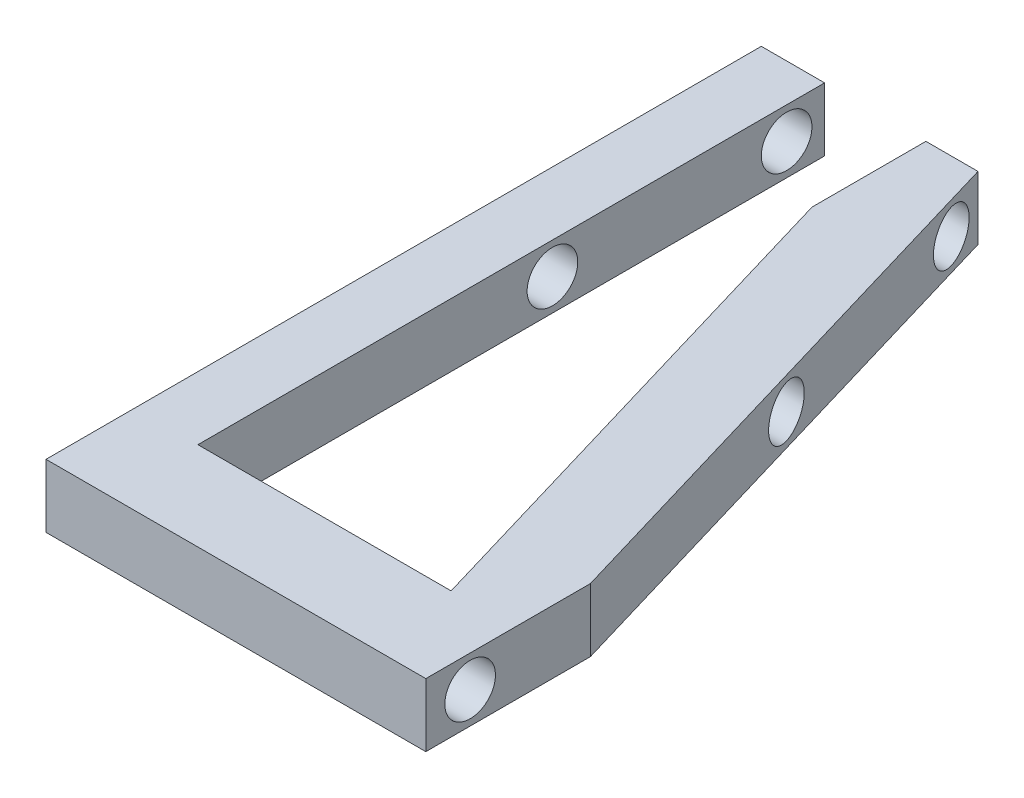
from build123d import *

# Parameters (mm, degrees)
BOSS_EXTRUDE1_DEPTH = 2.5
CUT_EXTRUDE1_REACH  = 59.935
SKETCH2_R           = 2


with BuildPart() as part:
    # Sketch1 → Boss-Extrude1 (new, symmetric)
    with BuildSketch(Plane(origin=(0, 0, 0), x_dir=(1, 0, 0), z_dir=(0, 1, 0))):
        Polygon((-9.999056518, 49.5), (-14.999056518, 49.5), (-14.999056518, -7), (15.000943482, -7), (15.000943482, 6), (2.115656451, 49.5), (-1.999056518, 49.5), (-1.999056518, 40.504950791), (9.999056518, 0), (-9.999056518, 0), align=None)
    extrude(amount=BOSS_EXTRUDE1_DEPTH, both=True)

    # Cut-Extrude1: up to this face of the body (flat: up to its plane)
    cut_extrude1_end = Plane(part.part.faces().sort_by_distance((15.000943482, 0, 0.5))[0])
    # Sketch2 → Cut-Extrude1 (cut, up to the picked face)
    with BuildSketch(Plane.ZY.offset(14.999056518), mode=Mode.PRIVATE) as cut_extrude1_sk1:
        with Locations(Location((-46.5, 0, 0), (0, 0, 180))):
            Circle(SKETCH2_R)
    cut_extrude1_tool1 = split(extrude(cut_extrude1_sk1.sketch, amount=-CUT_EXTRUDE1_REACH, mode=Mode.PRIVATE), bisect_by=cut_extrude1_end, keep=Keep.BOTH, mode=Mode.PRIVATE)
    # Sketch2 → Cut-Extrude1 (cut, up to the picked face)
    with BuildSketch(Plane.ZY.offset(14.999056518), mode=Mode.PRIVATE) as cut_extrude1_sk2:
        with Locations(Location((-28, 0, 0), (0, 0, 180))):
            Circle(SKETCH2_R)
    cut_extrude1_tool2 = split(extrude(cut_extrude1_sk2.sketch, amount=-CUT_EXTRUDE1_REACH, mode=Mode.PRIVATE), bisect_by=cut_extrude1_end, keep=Keep.BOTH, mode=Mode.PRIVATE)
    # Sketch2 → Cut-Extrude1 (cut, up to the picked face)
    with BuildSketch(Plane.ZY.offset(14.999056518), mode=Mode.PRIVATE) as cut_extrude1_sk3:
        with Locations((3.5, 0)):
            Circle(SKETCH2_R)
    cut_extrude1_tool3 = split(extrude(cut_extrude1_sk3.sketch, amount=-CUT_EXTRUDE1_REACH, mode=Mode.PRIVATE), bisect_by=cut_extrude1_end, keep=Keep.BOTH, mode=Mode.PRIVATE)
    add(cut_extrude1_tool1.solids().sort_by(Axis((-14.999057, 0, -46.5), (1, 0, 0)))[0], mode=Mode.SUBTRACT)
    add(cut_extrude1_tool2.solids().sort_by(Axis((-14.999057, 0, -28), (1, 0, 0)))[0], mode=Mode.SUBTRACT)
    add(cut_extrude1_tool3.solids().sort_by(Axis((-14.999057, 0, 3.5), (1, 0, 0)))[0], mode=Mode.SUBTRACT)


solid = part.part
